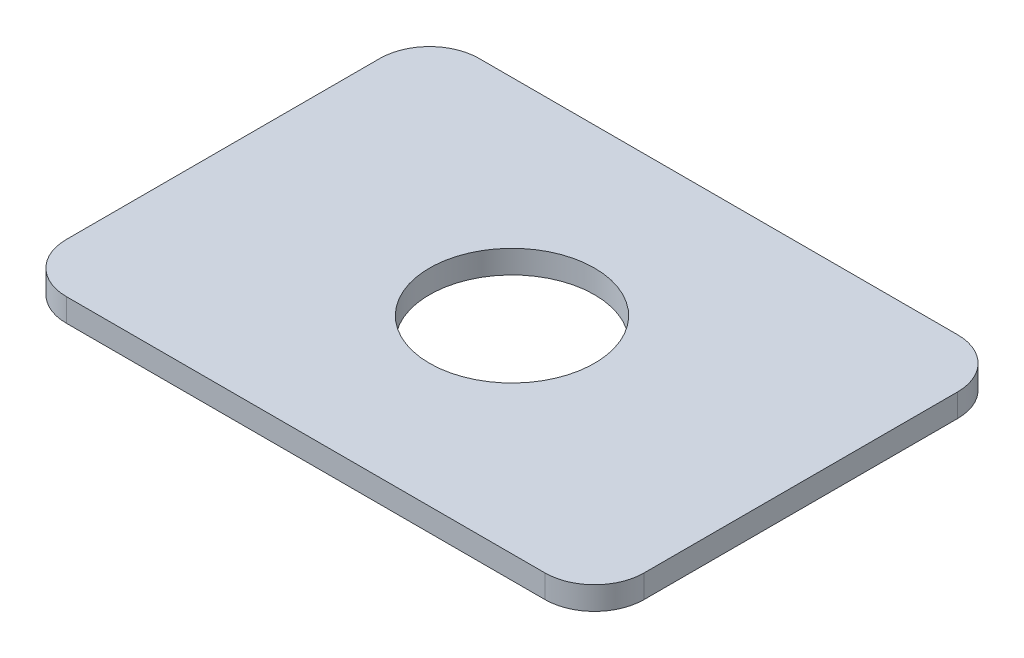
from build123d import *

# Parameters (mm, degrees)
SKETCH2_W           = 35
SKETCH2_H           = 25
BOSS_EXTRUDE1_DEPTH = 1.4
FILLET1_R           = 3
SKETCH3_R           = 5
CUT_EXTRUDE1_DEPTH  = 22.551334065


with BuildPart() as part:
    # Sketch2 → Boss-Extrude1 (new body)
    with BuildSketch(Plane(origin=(0, 0, 0), x_dir=(1, 0, 0), z_dir=(0, 1, 0))):
        Rectangle(SKETCH2_W, SKETCH2_H)
    extrude(amount=BOSS_EXTRUDE1_DEPTH)

    # Fillet1
    fillet1_edges = [part.edges().sort_by_distance(p)[0] for p in [
        (17.5, 0.7, 12.5),
        (-17.5, 0.7, 12.5),
        (-17.5, 0.7, -12.5),
        (17.5, 0.7, -12.5),
    ]]
    fillet(fillet1_edges, radius=FILLET1_R)

    # Sketch3 → Cut-Extrude1 (cut, through all)
    with BuildSketch(Plane(origin=(0, 1.4, 0), x_dir=(1, 0, 0), z_dir=(0, 1, 0))):
        with Locations(Location((0, 0, 0), (0, 0, 270))):
            Circle(SKETCH3_R)
    extrude(amount=-CUT_EXTRUDE1_DEPTH, mode=Mode.SUBTRACT)


solid = part.part
